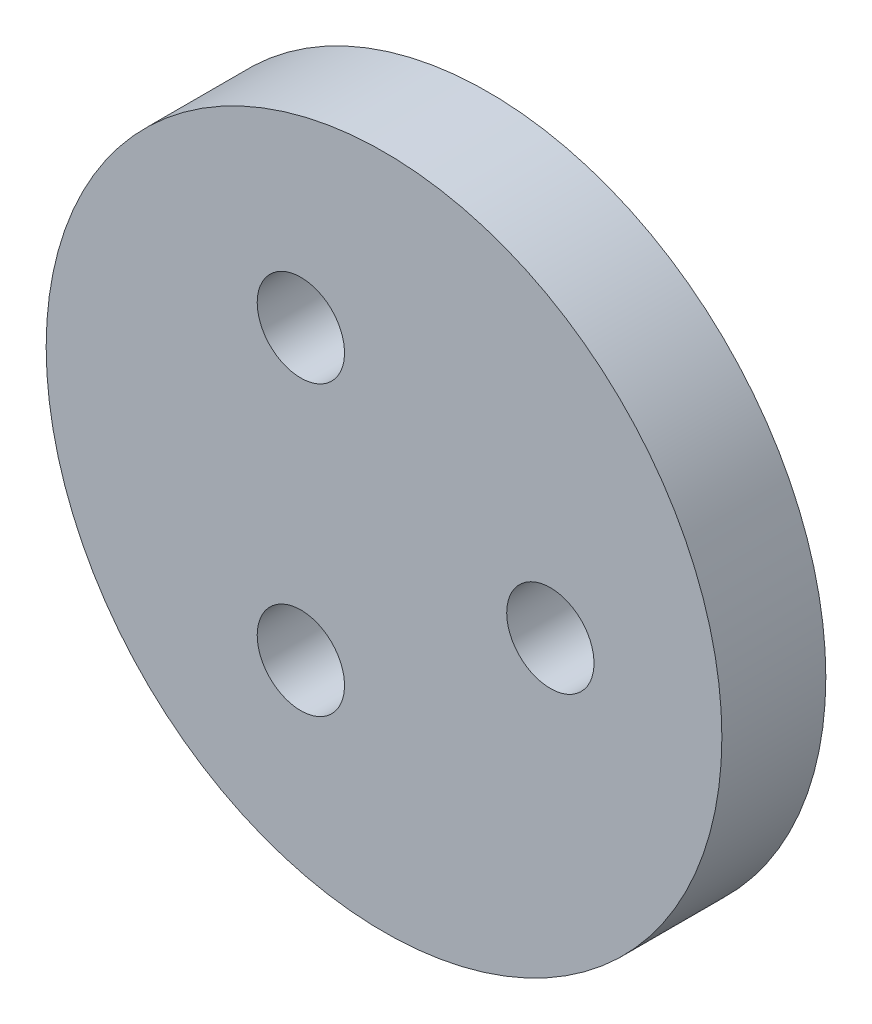
from build123d import *

# Parameters (mm, degrees)
SKETCH1_R           = 32.5
SKETCH1_R_2         = 4.2
BOSS_EXTRUDE1_DEPTH = 10


with BuildPart() as part:
    # Sketch1 → Boss-Extrude1 (new body)
    with BuildSketch(Plane.XY.offset(10)):
        with Locations(Location((0, 0, 0), (0, 0, 180))):
            Circle(SKETCH1_R)
        with Locations(Location((-8, 13.856406461, 0), (0, 0, 180))):
            Circle(SKETCH1_R_2, mode=Mode.SUBTRACT)
        with Locations(Location((-8, -13.856406461, 0), (0, 0, 180))):
            Circle(SKETCH1_R_2, mode=Mode.SUBTRACT)
        with Locations(Location((16, 0, 0), (0, 0, 180))):
            Circle(SKETCH1_R_2, mode=Mode.SUBTRACT)
    extrude(amount=-BOSS_EXTRUDE1_DEPTH)


solid = part.part
